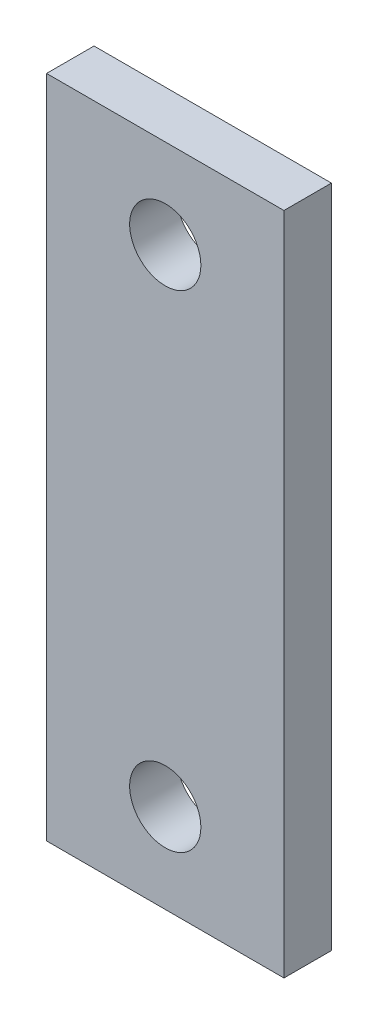
from build123d import *

# Parameters (mm, degrees)
BOSS_EXTRUDE1_DEPTH = 35
SKETCH3_R           = 1.5
CUT_EXTRUDE1_DEPTH  = 15
SKETCH2_W           = 4
SKETCH2_H           = 26
BOSS_EXTRUDE2_DEPTH = 20
BOSS_EXTRUDE3_DEPTH = 15
SKETCH6_R           = 3
CUT_EXTRUDE2_DEPTH  = 15
SKETCH7_W           = 15
SKETCH7_H           = 5
BOSS_EXTRUDE4_DEPTH = 31
CUT_EXTRUDE3_DEPTH  = 31


with BuildPart() as part:
    # Sketch1 → Boss-Extrude1 (new body)
    with BuildSketch(Plane.XY):
        Polygon((15.200344072, 13.760447293), (0.200344072, 13.760447293), (0.200344072, -6.239552707), (-4.799655928, -6.239552707), (-4.799655928, 19.760447293), (15.200344072, 19.760447293), align=None)
    extrude(amount=BOSS_EXTRUDE1_DEPTH)

    # Sketch3 → Cut-Extrude1 (cut)
    with BuildSketch(Plane.XZ.offset(-13.760447293)):
        with Locations((7.700344072, 29)):
            Circle(SKETCH3_R)
        with Locations((7.700344072, 22)):
            Circle(SKETCH3_R)
        with Locations((7.700344072, 15)):
            Circle(SKETCH3_R)
    extrude(amount=-CUT_EXTRUDE1_DEPTH, mode=Mode.SUBTRACT)

    # Sketch2 → Boss-Extrude2 (add)
    with BuildSketch(Plane.ZY.offset(4.799655928)):
        with Locations((2, 6.760447293)):
            Rectangle(SKETCH2_W, SKETCH2_H)
    extrude(amount=-BOSS_EXTRUDE2_DEPTH)

    # Sketch5 → Boss-Extrude3 (add)
    with BuildSketch(Plane(origin=(0, 19.760447293, 0), x_dir=(1, 0, 0), z_dir=(0, 1, 0))):
        Polygon((-4.799655928, -4), (0.200344072, -4), (15.200344072, -4), (15.200344072, 0), (-4.799655928, 0), align=None)
    boss_extrude3 = extrude(amount=BOSS_EXTRUDE3_DEPTH)

    # Mirror1: Boss-Extrude3 across plane
    add(boss_extrude3.mirror(Plane.ZX.offset(6.760447293)))

    # Sketch6 → Cut-Extrude2 (cut)
    with BuildSketch(Plane.XY.offset(4)):
        with Locations((5.200344072, -13.739552707)):
            Circle(SKETCH6_R)
        with Locations((5.200344072, 27.260447293)):
            Circle(SKETCH6_R)
    extrude(amount=-CUT_EXTRUDE2_DEPTH, mode=Mode.SUBTRACT)

    # Sketch7 → Boss-Extrude4 (add)
    with BuildSketch(Plane.XY.offset(4)):
        with Locations((7.700344072, -3.739552707)):
            Rectangle(SKETCH7_W, SKETCH7_H)
    extrude(amount=BOSS_EXTRUDE4_DEPTH)

    # Sketch8 → Cut-Extrude3 (cut)
    with BuildSketch(Plane.XY.offset(35)):
        Polygon((15.200344072, 13.760447293), (15.200344072, 19.760447293), (-4.799655928, 19.760447293), (-4.799655928, -6.239552707), (15.200344072, -6.239552707), (15.200344072, -1.239552707), (0.200344072, -1.239552707), (0.200344072, 13.760447293), align=None)
    extrude(amount=-CUT_EXTRUDE3_DEPTH, mode=Mode.SUBTRACT)


solid = part.part
